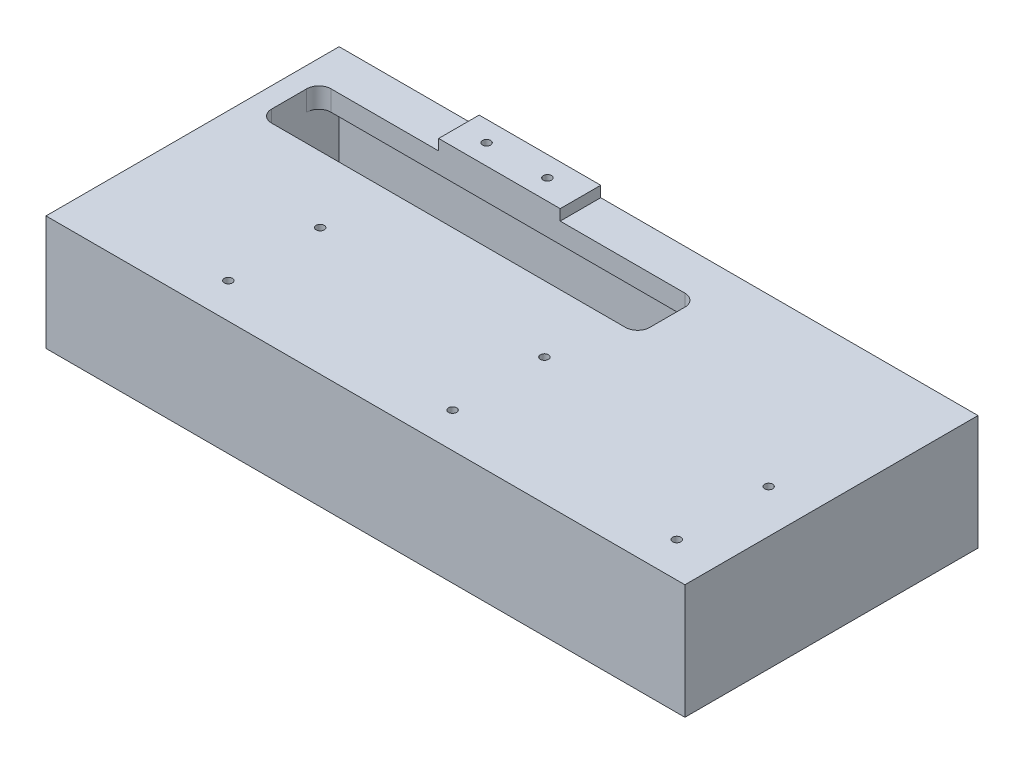
from build123d import *

# Parameters (mm, degrees)
SKETCH1_W           = 473
SKETCH1_H           = 217
BOSS_EXTRUDE1_DEPTH = 85
SKETCH2_W           = 280
SKETCH2_H           = 44
CUT_EXTRUDE1_DEPTH  = 15
SKETCH3_W           = 443
SKETCH3_H           = 187
CUT_EXTRUDE2_DEPTH  = 70
FILLET1_R           = 9
SKETCH4_W           = 90
SKETCH4_H           = 30
BOSS_EXTRUDE2_DEPTH = 8
SKETCH5_R           = 3
CUT_EXTRUDE3_DEPTH  = 15
SKETCH6_R           = 3
CUT_EXTRUDE4_DEPTH  = 15


with BuildPart() as part:
    # Sketch1 → Boss-Extrude1 (new body)
    with BuildSketch(Plane(origin=(0, 0, 0), x_dir=(1, 0, 0), z_dir=(0, 1, 0))):
        Rectangle(SKETCH1_W, SKETCH1_H)
    extrude(amount=BOSS_EXTRUDE1_DEPTH)

    # Sketch2 → Cut-Extrude1 (cut)
    with BuildSketch(Plane(origin=(0, 85, 0), x_dir=(1, 0, 0), z_dir=(0, 1, 0))):
        with Locations((-81.5, 56.5)):
            Rectangle(SKETCH2_W, SKETCH2_H)
    extrude(amount=-CUT_EXTRUDE1_DEPTH, mode=Mode.SUBTRACT)

    # Sketch3 → Cut-Extrude2 (cut)
    with BuildSketch(Plane.XZ):
        Rectangle(SKETCH3_W, SKETCH3_H)
    extrude(amount=-CUT_EXTRUDE2_DEPTH, mode=Mode.SUBTRACT)

    # Fillet1
    fillet1_edges = [part.edges().sort_by_distance(p)[0] for p in [
        (-221.5, 77.5, -34.5),
        (-221.5, 77.5, -78.5),
        (58.5, 77.5, -78.5),
        (58.5, 77.5, -34.5),
    ]]
    fillet(fillet1_edges, radius=FILLET1_R)

    # Sketch4 → Boss-Extrude2 (add)
    with BuildSketch(Plane(origin=(0, 85, 0), x_dir=(1, 0, 0), z_dir=(0, 1, 0))):
        with Locations((-87.81, 93.5)):
            Rectangle(SKETCH4_W, SKETCH4_H)
    extrude(amount=BOSS_EXTRUDE2_DEPTH)

    # Sketch5 → Cut-Extrude3 (cut)
    with BuildSketch(Plane(origin=(0, 93, 0), x_dir=(1, 0, 0), z_dir=(0, 1, 0))):
        with Locations(Location((-112.31, 93.5, 0), (0, 0, 270))):
            Circle(SKETCH5_R)
        with Locations(Location((-67.31, 93.5, 0), (0, 0, 270))):
            Circle(SKETCH5_R)
    extrude(amount=-CUT_EXTRUDE3_DEPTH, mode=Mode.SUBTRACT)

    # Sketch6 → Cut-Extrude4 (cut)
    with BuildSketch(Plane(origin=(0, 85, 0), x_dir=(1, 0, 0), z_dir=(0, 1, 0))):
        with Locations(Location((-127.5, -82.5, 0), (0, 0, 270))):
            Circle(SKETCH6_R)
        with Locations(Location((-127.5, -14.5, 0), (0, 0, 270))):
            Circle(SKETCH6_R)
        with Locations(Location((38.5, -14.5, 0), (0, 0, 270))):
            Circle(SKETCH6_R)
        with Locations(Location((204.5, -14.5, 0), (0, 0, 270))):
            Circle(SKETCH6_R)
        with Locations(Location((204.5, -82.5, 0), (0, 0, 270))):
            Circle(SKETCH6_R)
        with Locations(Location((38.5, -82.5, 0), (0, 0, 270))):
            Circle(SKETCH6_R)
    extrude(amount=-CUT_EXTRUDE4_DEPTH, mode=Mode.SUBTRACT)


solid = part.part
